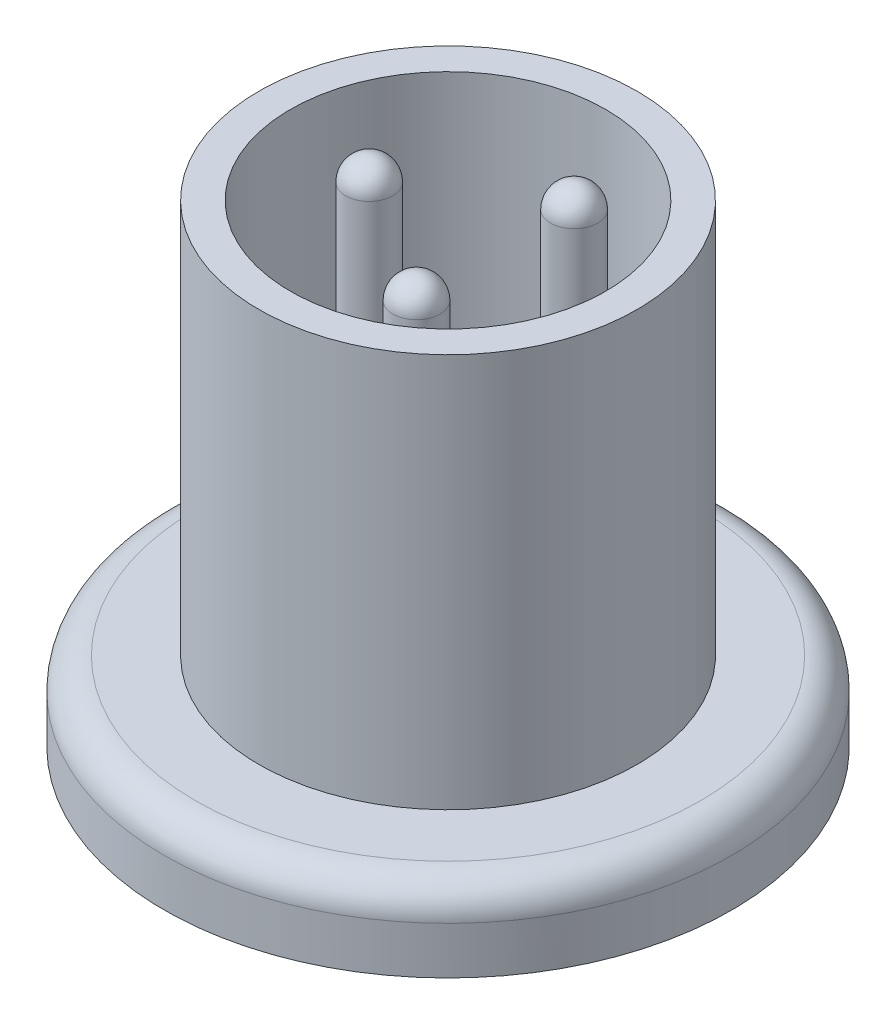
from build123d import *

# Parameters (mm, degrees)
SKETCH2_R           = 0.75
BOSS_EXTRUDE1_DEPTH = 12
FILLET1_R           = 0.75
FILLET2_R           = 1


with BuildPart() as part:
    # Sketch1 → Revolve1 (revolve)
    with BuildSketch(Plane.XY, mode=Mode.PRIVATE) as revolve1_sk:
        Polygon((0, 0), (9, 0), (9, 2.5), (6, 2.5), (6, 15), (5, 15), (5, 3), (0, 3), align=None)
    revolve(revolve1_sk.sketch.rotate(Axis((0, 0, 0), (0, 1, 0)), 90), axis=Axis((0, 0, 0), (0, 1, 0)))

    # Sketch2 → Boss-Extrude1 (add)
    with BuildSketch(Plane(origin=(0, 3, 0), x_dir=(1, 0, 0), z_dir=(0, 1, 0))):
        with Locations(Location((1.5, 2.5, 0), (0, 0, 270))):
            Circle(SKETCH2_R)
        with Locations(Location((1.5, -2.5, 0), (0, 0, 270))):
            Circle(SKETCH2_R)
        with Locations(Location((-2.5, 0, 0), (0, 0, 270))):
            Circle(SKETCH2_R)
    extrude(amount=BOSS_EXTRUDE1_DEPTH)

    # Fillet1
    fillet1_edges = [part.edges().sort_by_distance(p)[0] for p in [
        (1.5, 15, -3.25),
        (1.5, 15, 1.75),
        (-2.5, 15, -0.75),
    ]]
    fillet(fillet1_edges, radius=FILLET1_R)

    # Fillet2
    fillet2_edges = [part.edges().sort_by_distance(p)[0] for p in [
        (0, 2.5, 9),
    ]]
    fillet(fillet2_edges, radius=FILLET2_R)


solid = part.part
